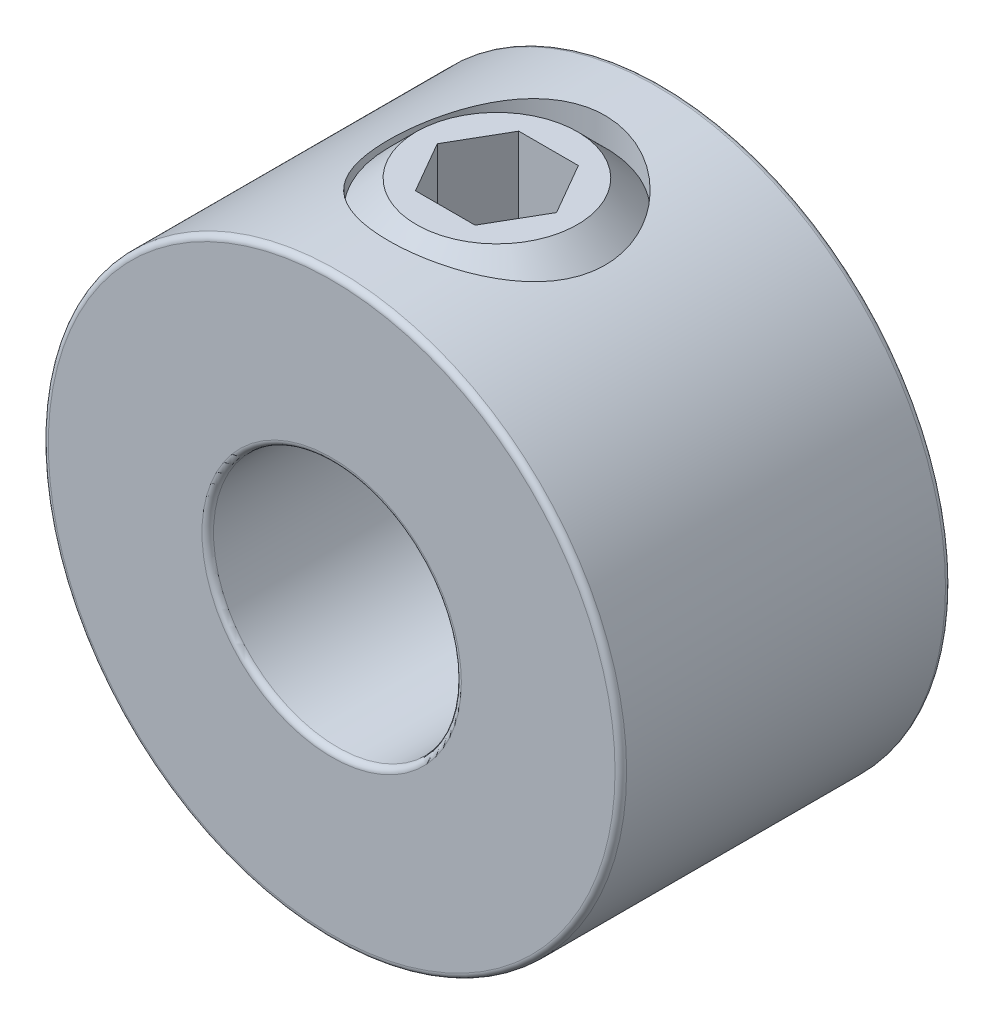
from build123d import *

# Parameters (mm, degrees)
SKETCH1_R          = 5.55625
SKETCH1_R_2        = 2.38125
EXTRUDE1_DEPTH     = 3.175
SKETCH2_R          = 2.0828
CUT_EXTRUDE1_DEPTH = 48.266462906
FILLET1_R          = 0.111125
CUT_EXTRUDE2_DEPTH = 1.984375


with BuildPart() as part:
    # Sketch1 → Extrude1 (new, symmetric)
    with BuildSketch(Plane.XY):
        Circle(SKETCH1_R)
        Circle(SKETCH1_R_2, mode=Mode.SUBTRACT)
    extrude(amount=EXTRUDE1_DEPTH, both=True)

    # Sketch2 → Cut-Extrude1 (cut, through all)
    with BuildSketch(Plane(origin=(41.275, 0, 0), x_dir=(0, 0, -1), z_dir=(0, -1, 0))):
        with Locations((0, -41.275)):
            Circle(SKETCH2_R)
    extrude(amount=-CUT_EXTRUDE1_DEPTH, mode=Mode.SUBTRACT)

    # Fillet1
    fillet1_edges = [part.edges().sort_by_distance(p)[0] for p in [
        (-5.55625, 0, -3.175),
        (-5.55625, 0, 3.175),
        (-2.38125, 0, -3.175),
        (-2.38125, 0, 3.175),
    ]]
    fillet(fillet1_edges, radius=FILLET1_R)


with BuildPart() as body_2:
    # Sketch3 → Revolve1 (revolve)
    with BuildSketch(Plane.XY):
        Polygon((-1.547302537, 2.38125), (-0.642596955, 2.38125), (0, 3.023846955), (0, 5.55625), (-1.547302537, 5.55625), (-2.0828, 5.020752537), (-2.0828, 2.916747463), align=None)
    revolve(axis=Axis((0, 2.38125, 0), (0, -1, 0)))

    # Sketch4 → Cut-Extrude2 (cut)
    with BuildSketch(Plane(origin=(3.3734375, 5.55625, 0), x_dir=(0, 0, -1), z_dir=(0, -1, 0))):
        Polygon((0, -2.22775806), (-0.9921875, -2.80059778), (-0.9921875, -3.94627722), (0, -4.51911694), (0.9921875, -3.94627722), (0.9921875, -2.80059778), align=None)
    extrude(amount=CUT_EXTRUDE2_DEPTH, mode=Mode.SUBTRACT)


solid = Compound([part.part, body_2.part])
